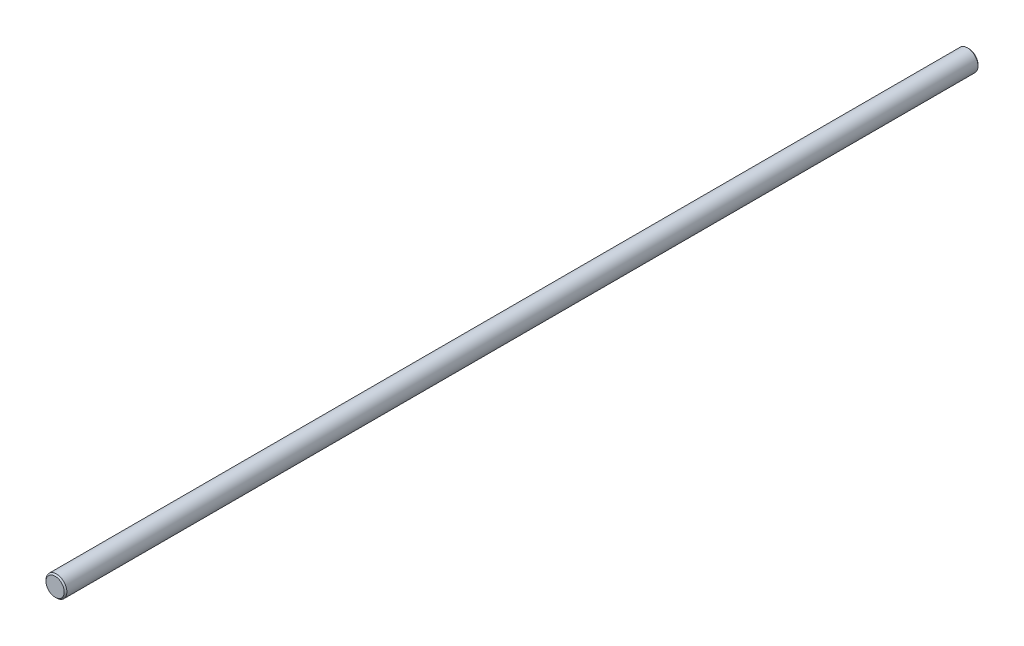
from build123d import *

# Parameters (mm, degrees)
ESQUISSE1_R        = 4
BOSS_EXTRU_1_DEPTH = 175
CHANFREIN1_SIZE    = 0.5


with BuildPart() as part:
    # Esquisse1 → Boss.-Extru.1 (new, symmetric)
    with BuildSketch(Plane.XY):
        Circle(ESQUISSE1_R)
    extrude(amount=BOSS_EXTRU_1_DEPTH, both=True)

    # Chanfrein1
    chanfrein1_edges = [part.edges().sort_by_distance(p)[0] for p in [
        (-4, 0, -175),
        (-4, 0, 175),
    ]]
    chamfer(chanfrein1_edges, length=CHANFREIN1_SIZE)


solid = part.part
